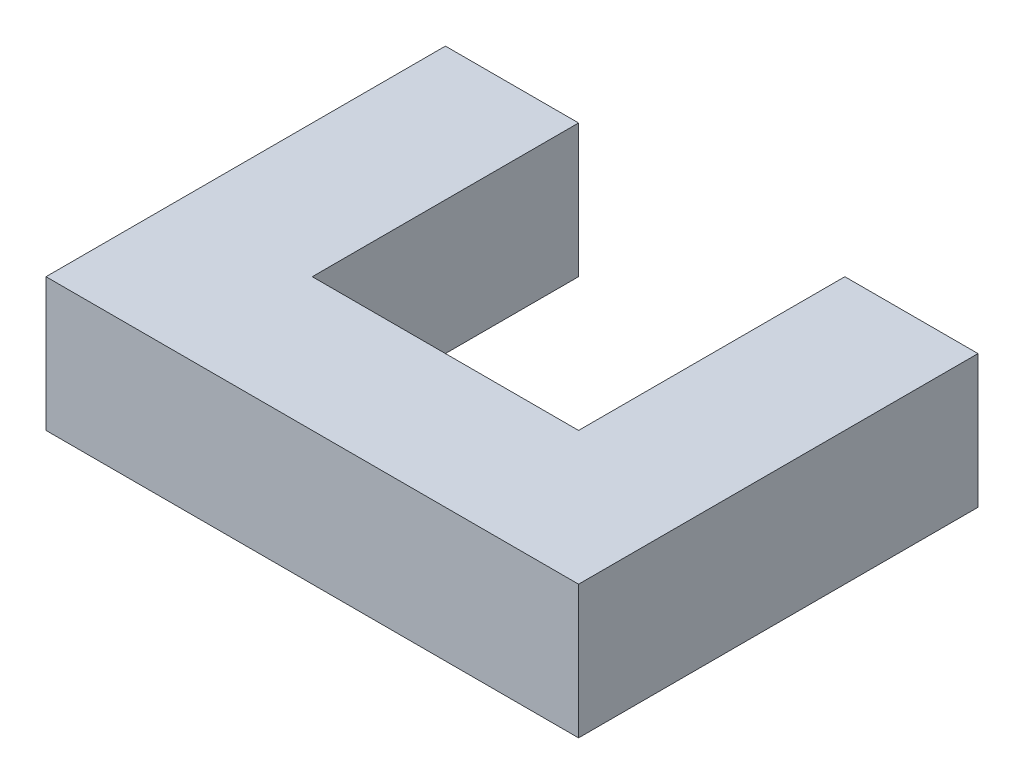
from build123d import *

# Parameters (mm, degrees)
BOSS_EXTRUDE1_DEPTH = 10


with BuildPart() as part:
    # Sketch1 → Boss-Extrude1 (new body)
    with BuildSketch(Plane(origin=(0, 0, 0), x_dir=(1, 0, 0), z_dir=(0, 1, 0))):
        Polygon((0, 0), (-40, 0), (-40, 30), (-30, 30), (-30, 10), (-10, 10), (-10, 30), (0, 30), align=None)
    extrude(amount=BOSS_EXTRUDE1_DEPTH)


solid = part.part
